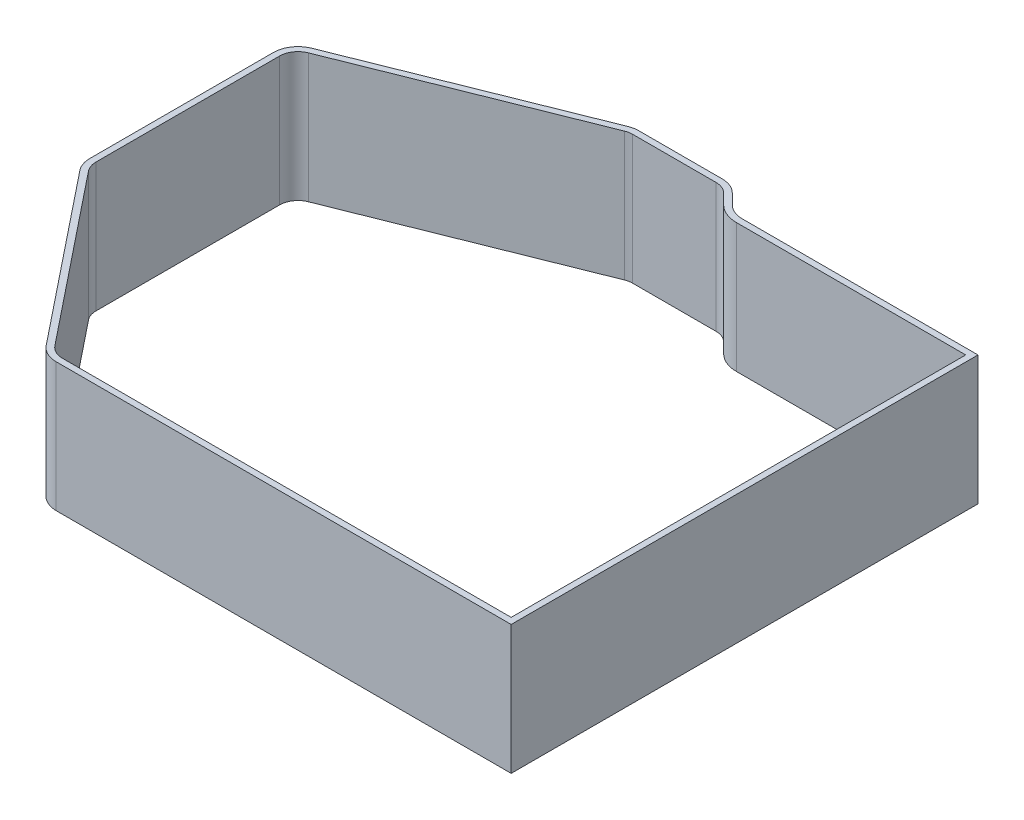
from build123d import *

# Parameters (mm, degrees)
RESSALTO_EXTRUS_O3_DEPTH = 10.5


with BuildPart() as part:
    # Esboço2 → Ressalto-extrusão3 (new body)
    with BuildSketch(Plane.XZ.offset(-2101.521299532)):
        with BuildLine():
            Line((1583.190356412, 82.728727741), (1546.151606107, 82.728727741))
            ThreePointArc((1546.151606107, 82.728727741), (1545.285228646, 82.531334214), (1544.589868488, 81.978117836))
            Line((1544.589868488, 81.978117836), (1533.628618793, 68.276555718))
            ThreePointArc((1533.628618793, 68.276555718), (1533.303099773, 67.689179505), (1533.190356412, 67.027165622))
            Line((1533.190356412, 67.027165622), (1533.190356412, 52.082793664))
            ThreePointArc((1533.190356412, 52.082793664), (1533.534221951, 50.961536045), (1534.447575059, 50.225840282))
            Line((1534.447575059, 50.225840282), (1552.832739866, 42.871774359))
            ThreePointArc((1552.832739866, 42.871774359), (1553.197306177, 42.764814968), (1553.575521219, 42.728727741))
            Line((1553.575521219, 42.728727741), (1560.361929287, 42.728727741))
            ThreePointArc((1560.361929287, 42.728727741), (1561.127296152, 42.880968676), (1561.776142849, 43.314514179))
            Line((1561.776142849, 43.314514179), (1562.604569974, 44.142941304))
            ThreePointArc((1562.604569974, 44.142941304), (1563.253416672, 44.576486806), (1564.018783537, 44.728727741))
            Line((1564.018783537, 44.728727741), (1583.190356412, 44.728727741))
            Line((1583.190356412, 44.728727741), (1583.190356412, 82.728727741))
        make_face()
        with BuildLine():
            Line((1564.018783537, 45.228727741), (1582.690356412, 45.228727741))
            Line((1582.690356412, 45.228727741), (1582.690356412, 82.228727741))
            Line((1582.690356412, 82.228727741), (1546.151606107, 82.228727741))
            ThreePointArc((1546.151606107, 82.228727741), (1545.501823011, 82.080682596), (1544.980302893, 81.665770313))
            Line((1544.980302893, 81.665770313), (1534.019053198, 67.964208194))
            ThreePointArc((1534.019053198, 67.964208194), (1533.774913933, 67.523676035), (1533.690356412, 67.027165622))
            Line((1533.690356412, 67.027165622), (1533.690356412, 52.082793664))
            ThreePointArc((1533.690356412, 52.082793664), (1533.948255566, 51.24185045), (1534.633270397, 50.690078628))
            Line((1534.633270397, 50.690078628), (1553.018435204, 43.336012705))
            ThreePointArc((1553.018435204, 43.336012705), (1553.291859937, 43.255793161), (1553.575521219, 43.228727741))
            Line((1553.575521219, 43.228727741), (1560.361929287, 43.228727741))
            ThreePointArc((1560.361929287, 43.228727741), (1560.935954436, 43.342908442), (1561.422589459, 43.668067569))
            Line((1561.422589459, 43.668067569), (1562.251016584, 44.496494694))
            ThreePointArc((1562.251016584, 44.496494694), (1563.062074956, 45.038426572), (1564.018783537, 45.228727741))
        make_face(mode=Mode.SUBTRACT)
    extrude(amount=-RESSALTO_EXTRUS_O3_DEPTH)


solid = part.part
